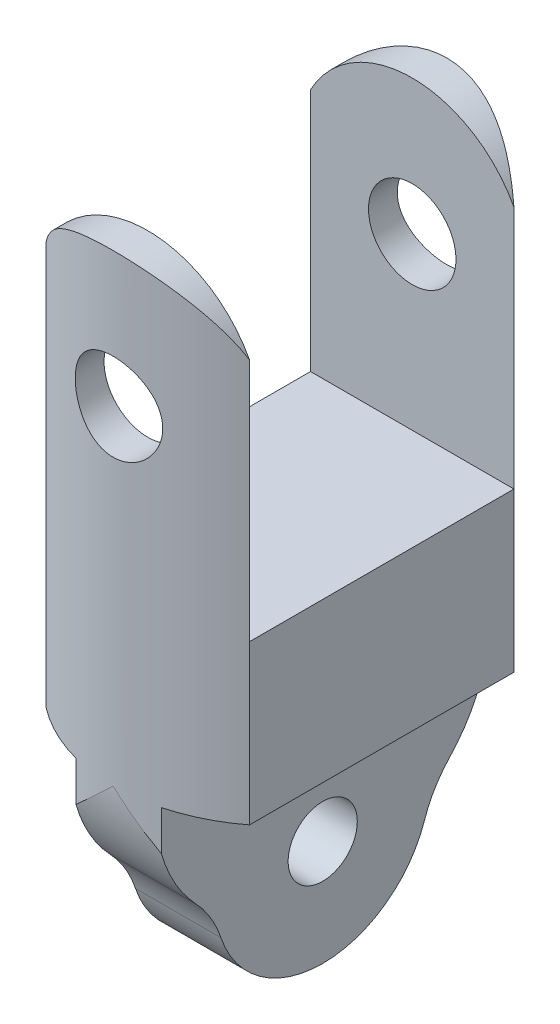
from build123d import *

# Parameters (mm, degrees)
SKETCH2_R               = 4.1
BOSS_EXTRUDE1_DEPTH     = 3.9
CUT_EXTRUDE1_DEPTH      = 7.987846592
BOSS_EXTRUDE2_DEPTH     = 7.5
CUT_EXTRUDE2_DEPTH      = 15.263590011
CUT_EXTRUDE2_DEPTH_BACK = 15.263590011
SKETCH5_R               = 1.075
CUT_EXTRUDE3_DEPTH      = 15.263590166
BOSS_EXTRUDE3_DEPTH     = 1.05
CUT_EXTRUDE4_DEPTH      = 13.370125448
CUT_EXTRUDE5_REACH      = 14.624
SKETCH9_R               = 0.85


with BuildPart() as part:
    # Sketch2 → Boss-Extrude1 (new body)
    with BuildSketch(Plane(origin=(0, 0, 0), x_dir=(1, 0, 0), z_dir=(0, 1, 0))):
        with Locations(Location((0, 0, 0), (0, 0, 270))):
            Circle(SKETCH2_R)
    extrude(amount=BOSS_EXTRUDE1_DEPTH)

    # Sketch3 → Cut-Extrude1 (cut, through all)
    with BuildSketch(Plane(origin=(0, 3.9, 0), x_dir=(1, 0, 0), z_dir=(0, 1, 0))):
        with BuildLine():
            Line((-2.5, 3.249615362), (-2.5, -3.249615362))
            ThreePointArc((-2.5, -3.249615362), (-4.1, 0), (-2.5, 3.249615362))
        make_face()
        with BuildLine():
            Line((2.5, 3.249615362), (2.5, -3.249615362))
            ThreePointArc((2.5, -3.249615362), (4.1, 0), (2.5, 3.249615362))
        make_face()
    extrude(amount=-CUT_EXTRUDE1_DEPTH, mode=Mode.SUBTRACT)

    # Sketch4 → Boss-Extrude2 (add)
    with BuildSketch(Plane(origin=(0, 3.9, 0), x_dir=(1, 0, 0), z_dir=(0, 1, 0))):
        with BuildLine():
            Line((-2.5, -3.249615362), (2.5, -3.249615362))
            ThreePointArc((2.5, -3.249615362), (0, -4.1), (-2.5, -3.249615362))
        make_face()
        with BuildLine():
            Line((-2.5, 3.249615362), (2.5, 3.249615362))
            ThreePointArc((2.5, 3.249615362), (0, 4.1), (-2.5, 3.249615362))
        make_face()
    extrude(amount=BOSS_EXTRUDE2_DEPTH)

    # Sketch5 → Cut-Extrude2 (cut, two sides: drawn at the far end of the back side and taken through both)
    with BuildSketch(Plane.XY.offset(4.1).offset(-CUT_EXTRUDE2_DEPTH_BACK)):
        with Locations(Location((0, 8.075, 0), (0, 0, 270))):
            Circle(SKETCH5_R)
    extrude(amount=CUT_EXTRUDE2_DEPTH + CUT_EXTRUDE2_DEPTH_BACK, mode=Mode.SUBTRACT)

    # Sketch6 → Cut-Extrude3 (cut, through all)
    with BuildSketch(Plane.XY.offset(4.1)):
        with BuildLine():
            Line((-2.5, 9.9), (-2.5, 11.4))
            Line((-2.5, 11.4), (0, 11.4))
            ThreePointArc((0, 11.4), (-1.457737974, 10.996229956), (-2.5, 9.9))
        make_face()
    cut_extrude3 = extrude(amount=-CUT_EXTRUDE3_DEPTH, mode=Mode.SUBTRACT)

    # Mirror1: Cut-Extrude3 across plane
    add(cut_extrude3.mirror(Plane(origin=(0, 0, 0), x_dir=(0, 0, 1), z_dir=(1, 0, 0))), mode=Mode.SUBTRACT)

    # Sketch7 → Boss-Extrude3 (add, symmetric)
    with BuildSketch(Plane(origin=(0, 0, 0), x_dir=(0, 0, -1), z_dir=(1, 0, 0))):
        with BuildLine():
            Line((4.1, 0), (-4.1, 0))
            ThreePointArc((-4.1, 0), (-3.845898176, -1.328520002), (-3.11946367, -2.469495917))
            ThreePointArc((-3.11946367, -2.469495917), (-2.754870811, -2.951250255), (-2.502108249, -3.5))
            ThreePointArc((-2.502108249, -3.5), (0, -5.3), (2.502108249, -3.5))
            ThreePointArc((2.502108249, -3.5), (2.754870811, -2.951250255), (3.11946367, -2.469495917))
            ThreePointArc((3.11946367, -2.469495917), (3.845898176, -1.328520002), (4.1, 0))
        make_face()
    extrude(amount=BOSS_EXTRUDE3_DEPTH, both=True)

    # Sketch8 → Cut-Extrude4 (cut, through all)
    with BuildSketch(Plane(origin=(0, 0, 0), x_dir=(1, 0, 0), z_dir=(0, 1, 0))):
        with BuildLine():
            Line((-1.05, -3.963268853), (-1.05, -4.1))
            Line((-1.05, -4.1), (0, -4.1))
            ThreePointArc((0, -4.1), (-0.529432575, -4.065673517), (-1.05, -3.963268853))
        make_face()
        with BuildLine():
            Line((-1.05, 4.1), (0, 4.1))
            ThreePointArc((0, 4.1), (-0.529432575, 4.065673517), (-1.05, 3.963268853))
            Line((-1.05, 3.963268853), (-1.05, 4.1))
        make_face()
    cut_extrude4 = extrude(amount=-CUT_EXTRUDE4_DEPTH, mode=Mode.SUBTRACT)

    # Mirror2: Cut-Extrude4 across plane
    add(cut_extrude4.mirror(Plane(origin=(0, 0, 0), x_dir=(0, 0, 1), z_dir=(1, 0, 0))), mode=Mode.SUBTRACT)

    # Sketch9 → Cut-Extrude5 (cut, up to next)
    with BuildSketch(Plane(origin=(1.05, 0, 0), x_dir=(0, 0, -1), z_dir=(1, 0, 0)), mode=Mode.PRIVATE) as cut_extrude5_sk1:
        with Locations((0, -2.7)):
            Circle(SKETCH9_R)
    cut_extrude5_tool1 = extrude(cut_extrude5_sk1.sketch, amount=-CUT_EXTRUDE5_REACH, mode=Mode.PRIVATE) & part.part
    add(cut_extrude5_tool1.solids().sort_by_distance((1.05, -2.7, 0))[0], mode=Mode.SUBTRACT)


solid = part.part
